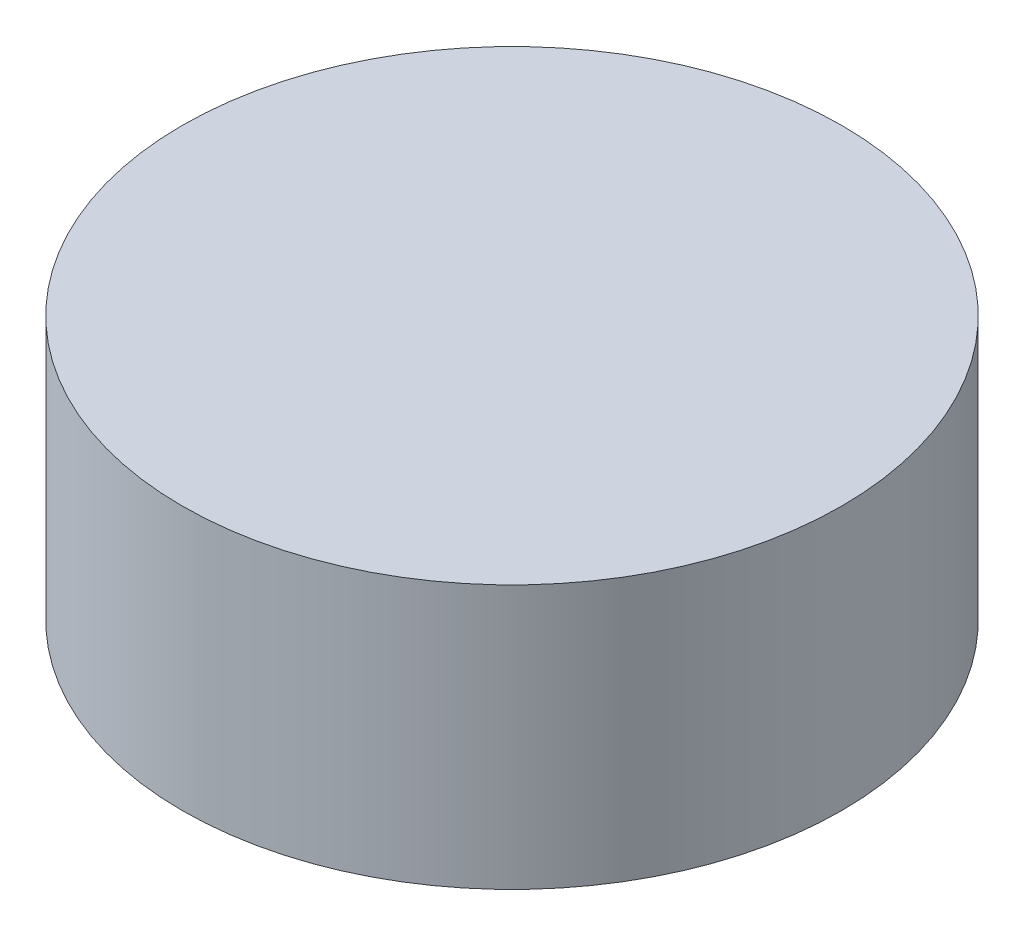
from build123d import *

# Parameters (mm, degrees)
SKETCH_1_R      = 2.5
EXTRUDE_1_DEPTH = 2


with BuildPart() as part:
    # 스케치1 → 보스-돌출1 (new body)
    with BuildSketch(Plane(origin=(0, 0, 0), x_dir=(1, 0, 0), z_dir=(0, 1, 0))):
        with Locations(Location((0, 0, 0), (0, 0, 270))):
            Circle(SKETCH_1_R)
    extrude(amount=EXTRUDE_1_DEPTH)


solid = part.part
